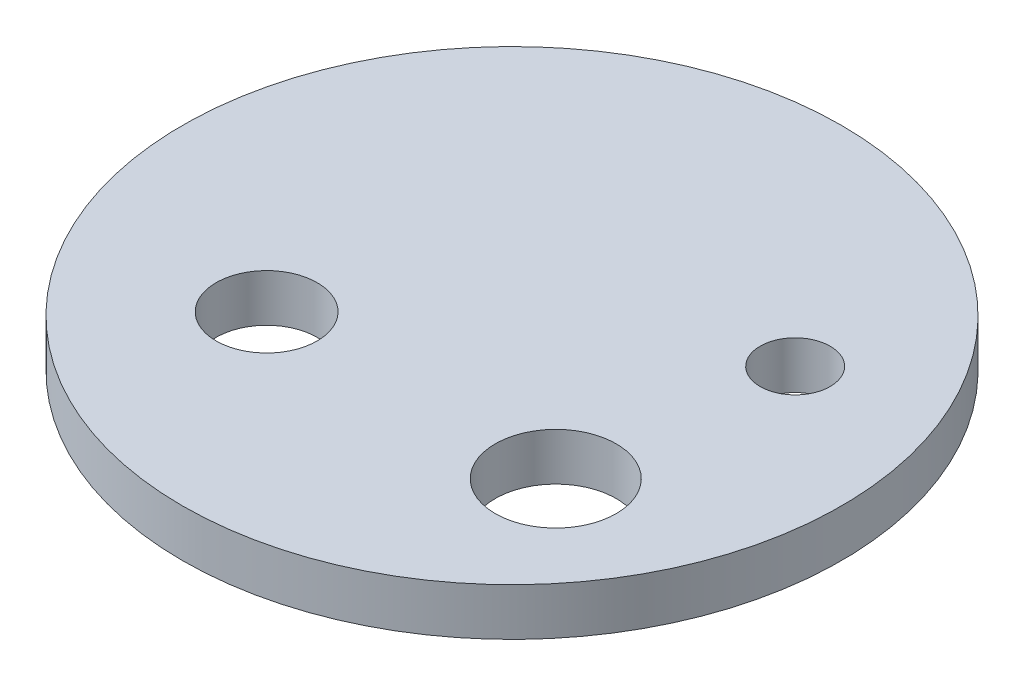
from build123d import *

# Parameters (mm, degrees)
SKETCH1_R           = 69.51310051
SKETCH1_R_2         = 7.382801066
SKETCH1_R_3         = 12.758368882
SKETCH1_R_4         = 10.657860306
BOSS_EXTRUDE1_DEPTH = 10


with BuildPart() as part:
    # Sketch1 → Boss-Extrude1 (new body)
    with BuildSketch(Plane(origin=(0, 0, 0), x_dir=(1, 0, 0), z_dir=(0, 1, 0))):
        with Locations(Location((0, 0, 0), (0, 0, 270))):
            Circle(SKETCH1_R)
        with Locations(Location((39.128845652, 20.598014975, 0), (0, 0, 270))):
            Circle(SKETCH1_R_2, mode=Mode.SUBTRACT)
        with Locations(Location((34.403852969, -25.175351636, 0), (0, 0, 270))):
            Circle(SKETCH1_R_3, mode=Mode.SUBTRACT)
        with Locations(Location((-26.578083839, -25.175351636, 0), (0, 0, 270))):
            Circle(SKETCH1_R_4, mode=Mode.SUBTRACT)
    extrude(amount=BOSS_EXTRUDE1_DEPTH)


solid = part.part
